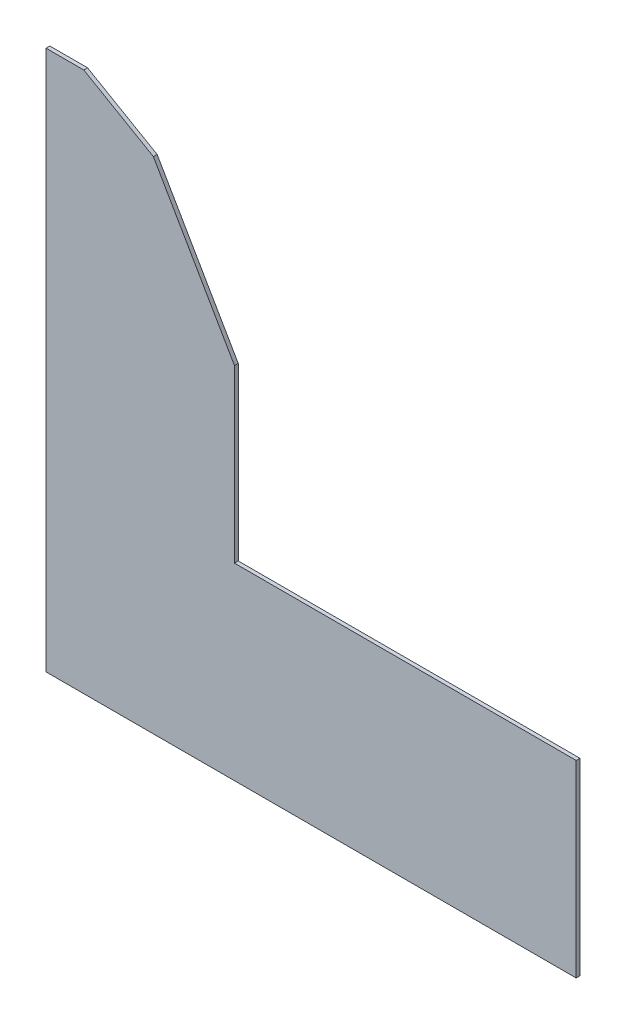
from build123d import *

# Parameters (mm, degrees)
SKETCH1_W           = 211
SKETCH1_H           = 75
BOSS_EXTRUDE1_DEPTH = 1.5
BOSS_EXTRUDE2_DEPTH = 1.5


with BuildPart() as part:
    # Sketch1 → Boss-Extrude1 (new body)
    with BuildSketch(Plane.XY):
        with Locations((105.5, -37.5)):
            Rectangle(SKETCH1_W, SKETCH1_H)
    extrude(amount=BOSS_EXTRUDE1_DEPTH)

    # Sketch2 → Boss-Extrude2 (add)
    with BuildSketch(Plane.XY):
        Polygon((0, 0), (0, 140), (15, 140), (42.712812921, 124), (75, 68.076951546), (75, 0), align=None)
    extrude(amount=BOSS_EXTRUDE2_DEPTH)


solid = part.part
